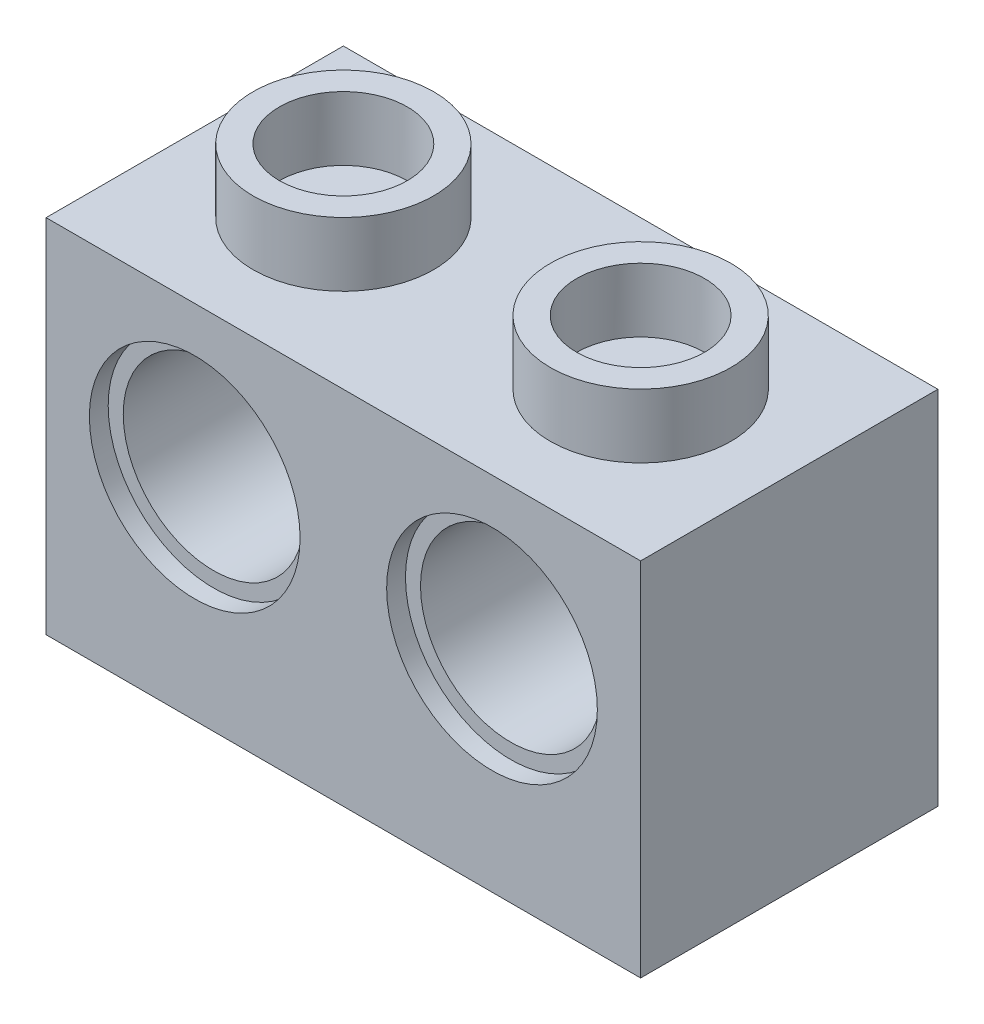
from build123d import *

# Parameters (mm, degrees)
SKETCH1_W           = 7.9
SKETCH1_H           = 7.9
BOSS_EXTRUDE1_DEPTH = 9.6
CUT_EXTRUDE1_DEPTH  = 9.6
SKETCH3_R           = 2.8
CUT_EXTRUDE2_DEPTH  = 0.5
CUT_EXTRUDE3_START  = -0.5
SKETCH4_R           = 2.8
SKETCH4_R_2         = 2.4
CUT_EXTRUDE3_DEPTH  = 0.5
SKETCH5_R           = 2.4
BOSS_EXTRUDE2_DEPTH = 1.7
CUT_EXTRUDE4_DEPTH  = 1.7


with BuildPart() as part:
    # Sketch1 → Boss-Extrude1 (new body)
    with BuildSketch(Plane(origin=(0, 0, 0), x_dir=(1, 0, 0), z_dir=(0, 1, 0))):
        with Locations((3.95, 3.95)):
            Rectangle(SKETCH1_W, SKETCH1_H)
    extrude(amount=BOSS_EXTRUDE1_DEPTH)

    # Sketch2 → Cut-Extrude1 (cut)
    with BuildSketch(Plane.XY):
        with BuildLine():
            ThreePointArc((3.95, 7.999162379), (1.55, 5.599162379), (3.95, 3.199162379))
            Line((3.95, 3.199162379), (3.95, 3.2))
            Line((3.95, 3.2), (3.95, 7.998324758))
            Line((3.95, 7.998324758), (3.95, 7.999162379))
        make_face()
        with BuildLine():
            Line((3.95, 3.2), (3.95, 3.199162379))
            ThreePointArc((3.95, 3.199162379), (5.647056275, 3.902106104), (6.35, 5.599162379))
            ThreePointArc((6.35, 5.599162379), (5.647056275, 7.296218654), (3.95, 7.999162379))
            Line((3.95, 7.999162379), (3.95, 7.998324758))
            Line((3.95, 7.998324758), (3.95, 3.2))
        make_face()
    extrude(amount=-CUT_EXTRUDE1_DEPTH, mode=Mode.SUBTRACT)

    # Sketch3 → Cut-Extrude2 (cut)
    with BuildSketch(Plane.XY):
        with Locations((3.95, 5.599162379)):
            Circle(SKETCH3_R)
    extrude(amount=-CUT_EXTRUDE2_DEPTH, mode=Mode.SUBTRACT)

    # Sketch4 → Cut-Extrude3 (cut)
    with BuildSketch(Plane(origin=(0, 0, -7.9), x_dir=(-1, 0, 0), z_dir=(0, 0, -1)).offset(CUT_EXTRUDE3_START)):
        with Locations(Location((-3.95, 5.599162379, 0), (0, 0, 180))):
            Circle(SKETCH4_R)
        with Locations(Location((-3.95, 5.599162379, 0), (0, 0, 180))):
            Circle(SKETCH4_R_2, mode=Mode.SUBTRACT)
    extrude(amount=CUT_EXTRUDE3_DEPTH, mode=Mode.SUBTRACT)

    # Sketch5 → Boss-Extrude2 (add)
    with BuildSketch(Plane(origin=(0, 9.6, 0), x_dir=(1, 0, 0), z_dir=(0, 1, 0))):
        with Locations(Location((3.95, 3.95, 0), (0, 0, 270))):
            Circle(SKETCH5_R)
    extrude(amount=BOSS_EXTRUDE2_DEPTH)

    # Sketch6 → Cut-Extrude4 (cut)
    with BuildSketch(Plane(origin=(0, 11.3, 0), x_dir=(1, 0, 0), z_dir=(0, 1, 0))):
        with BuildLine():
            ThreePointArc((5.65, 3.95), (3.95, 5.65), (2.25, 3.95))
            Line((2.25, 3.95), (5.65, 3.95))
        make_face()
        with BuildLine():
            Line((5.65, 3.95), (2.25, 3.95))
            ThreePointArc((2.25, 3.95), (3.95, 2.25), (5.65, 3.95))
        make_face()
    extrude(amount=-CUT_EXTRUDE4_DEPTH, mode=Mode.SUBTRACT)

    # Mirror1: part across plane


with BuildPart() as part_1:
    add(part.part)
    add(part.part.mirror(Plane(origin=(7.9, 9.6, 0), x_dir=(0, 0, 1), z_dir=(-1, 0, 0))))


solid = part_1.part
